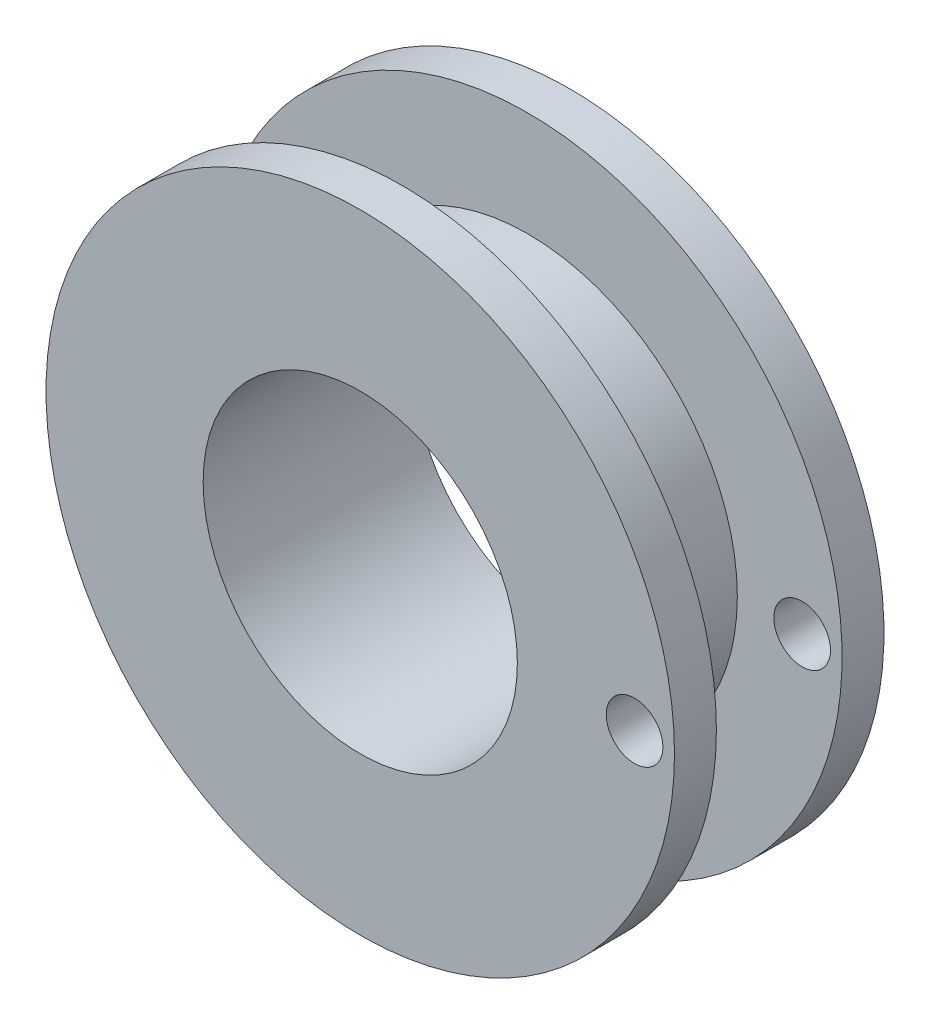
from build123d import *

# Parameters (mm, degrees)
SKETCH_2_R               = 10
EXTRUDE_1_DEPTH          = 6
SKETCH_3_R               = 15
EXTRUDE_2_DEPTH          = 2
EXTRUDE_START            = 2
SKETCH_4_R               = 15
EXTRUDE_3_DEPTH          = 2
CUT_EXTRUDE_1_DEPTH      = 24.452078799
CUT_EXTRUDE_1_DEPTH_BACK = 24.452078799
SKETCH_5_R               = 7.5
CUT_EXTRUDE_2_DEPTH      = 24.452078799
CUT_EXTRUDE_2_DEPTH_BACK = 24.452078799
SKETCH_6_R               = 1.351786052


with BuildPart() as part:
    # 스케치2 → 보스-돌출1 (new body)
    with BuildSketch(Plane.XY):
        Circle(SKETCH_2_R)
    extrude(amount=EXTRUDE_1_DEPTH)

    # 스케치3 → 보스-돌출2 (add)
    with BuildSketch(Plane(origin=(0, 0, 0), x_dir=(-1, 0, 0), z_dir=(0, 0, -1))):
        Circle(SKETCH_3_R)
    extrude(amount=EXTRUDE_2_DEPTH)

    # 스케치4 → 보스-돌출3 (add)
    with BuildSketch(Plane.XY.offset(6).offset(EXTRUDE_START)):
        with Locations(Location((0, 0, 0), (0, 0, 180))):
            Circle(SKETCH_4_R)
    extrude(amount=-EXTRUDE_3_DEPTH)

    # 스케치5 → 컷-돌출1 (cut, two sides: drawn at the far end of the back side and taken through both)
    with BuildSketch(Plane.XY.offset(8).offset(-CUT_EXTRUDE_1_DEPTH_BACK)):
        Circle(SKETCH_5_R)
    extrude(amount=CUT_EXTRUDE_1_DEPTH + CUT_EXTRUDE_1_DEPTH_BACK, mode=Mode.SUBTRACT)

    # 스케치6 → 컷-돌출2 (cut, two sides: drawn at the far end of the back side and taken through both)
    with BuildSketch(Plane.XY.offset(8).offset(-CUT_EXTRUDE_2_DEPTH_BACK)):
        with Locations((13.094626163, 0)):
            Circle(SKETCH_6_R)
    extrude(amount=CUT_EXTRUDE_2_DEPTH + CUT_EXTRUDE_2_DEPTH_BACK, mode=Mode.SUBTRACT)


solid = part.part
